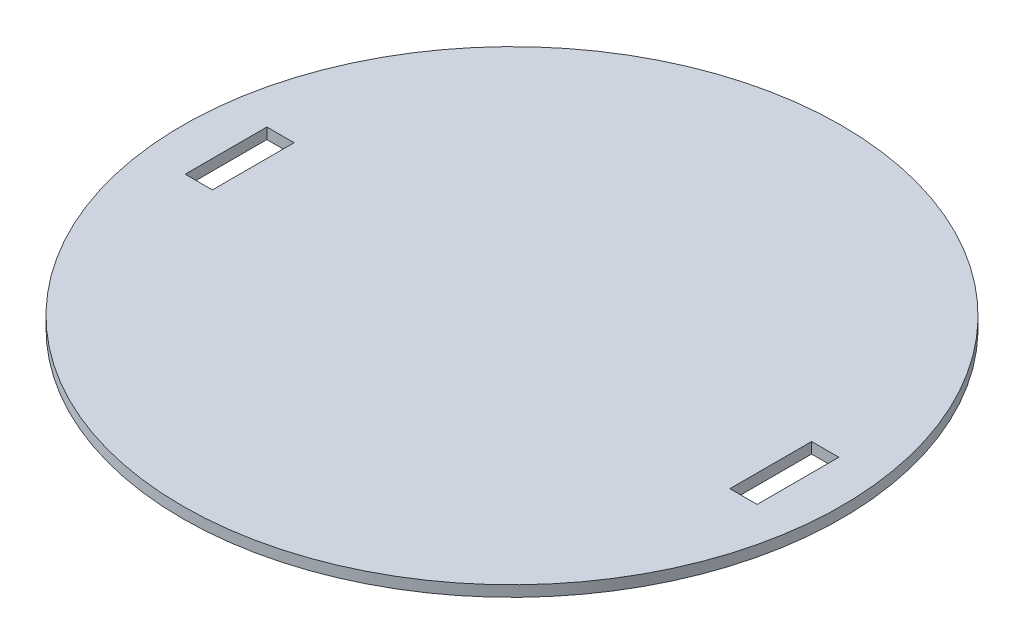
from build123d import *

# Parameters (mm, degrees)
BOTTOM_R             = 121
BOTTOM_W             = 10
BOTTOM_H             = 30
BOTTOM_EXTRUDE_DEPTH = 4


with BuildPart() as part:
    # Bottom → Bottom-Extrude (new body)
    with BuildSketch(Plane(origin=(0, 0, 0), x_dir=(-1, 0, 0), z_dir=(0, 1, 0))):
        with Locations(Location((0, 0, 0), (0, 0, 90))):
            Circle(BOTTOM_R)
        with Locations((100, 0)):
            Rectangle(BOTTOM_W, BOTTOM_H, mode=Mode.SUBTRACT)
        with Locations((-100, 0)):
            Rectangle(BOTTOM_W, BOTTOM_H, mode=Mode.SUBTRACT)
    extrude(amount=BOTTOM_EXTRUDE_DEPTH)


solid = part.part
